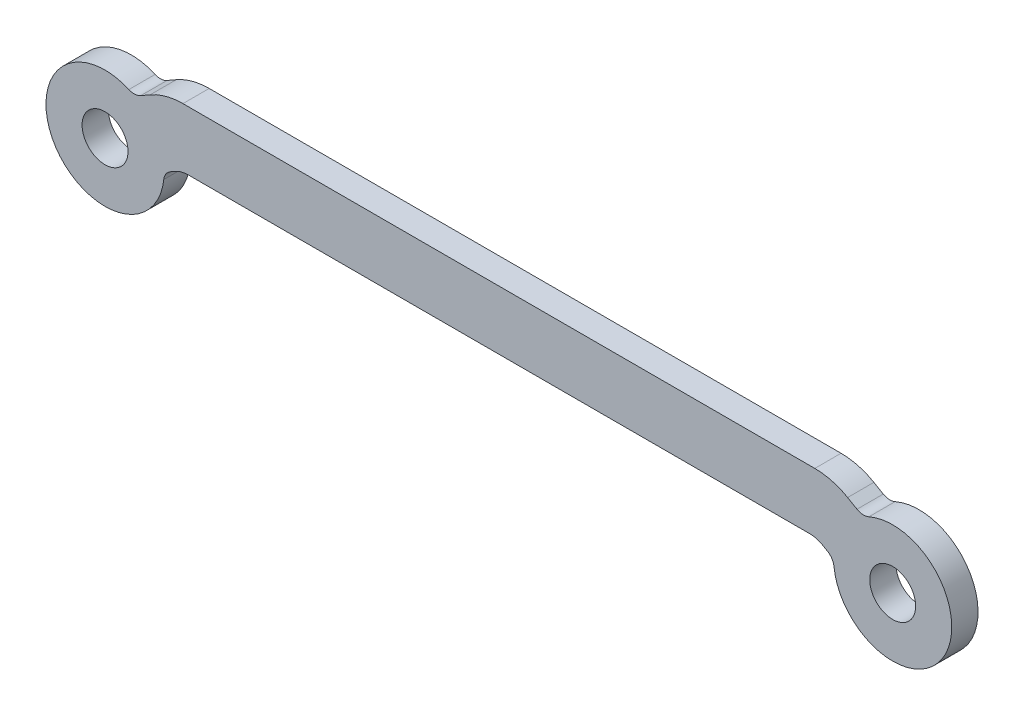
from build123d import *

# Parameters (mm, degrees)
SKETCH1_R           = 1.75
BOSS_EXTRUDE1_DEPTH = 2


with BuildPart() as part:
    # Sketch1 → Boss-Extrude1 (new body)
    with BuildSketch(Plane.XY):
        with BuildLine():
            Line((2.717606537, 4.167087077), (3.433012702, 4.580127019))
            ThreePointArc((3.433012702, 4.580127019), (4.638917476, 5.079629131), (5.933012702, 5.25))
            Line((5.933012702, 5.25), (54.066987298, 5.25))
            ThreePointArc((54.066987298, 5.25), (55.361082524, 5.079629131), (56.566987298, 4.580127019))
            Line((56.566987298, 4.580127019), (57.282393463, 4.167087077))
            ThreePointArc((57.282393463, 4.167087077), (57.728126896, 4.034585997), (58.185594651, 4.118001121))
            ThreePointArc((58.185594651, 4.118001121), (63.897114317, -2.25), (55.526503742, -0.487679436))
            ThreePointArc((55.526503742, -0.487679436), (55.370009481, -0.049793176), (55.032393463, 0.26997276))
            Line((55.032393463, 0.26997276), (54.665063509, 0.482050808))
            ThreePointArc((54.665063509, 0.482050808), (54.1827016, 0.681851653), (53.665063509, 0.75))
            Line((53.665063509, 0.75), (6.350969201, 0.75))
            ThreePointArc((6.350969201, 0.75), (5.817844702, 0.679812828), (5.321051756, 0.474034452))
            Line((5.321051756, 0.474034452), (4.967606537, 0.26997276))
            ThreePointArc((4.967606537, 0.26997276), (4.629990519, -0.049793176), (4.473496258, -0.487679436))
            ThreePointArc((4.473496258, -0.487679436), (-3.897114317, -2.25), (1.814405349, 4.118001121))
            ThreePointArc((1.814405349, 4.118001121), (2.271873104, 4.034585997), (2.717606537, 4.167087077))
        make_face()
        Circle(SKETCH1_R, mode=Mode.SUBTRACT)
        with Locations((60, 0)):
            Circle(SKETCH1_R, mode=Mode.SUBTRACT)
    extrude(amount=BOSS_EXTRUDE1_DEPTH)


solid = part.part
